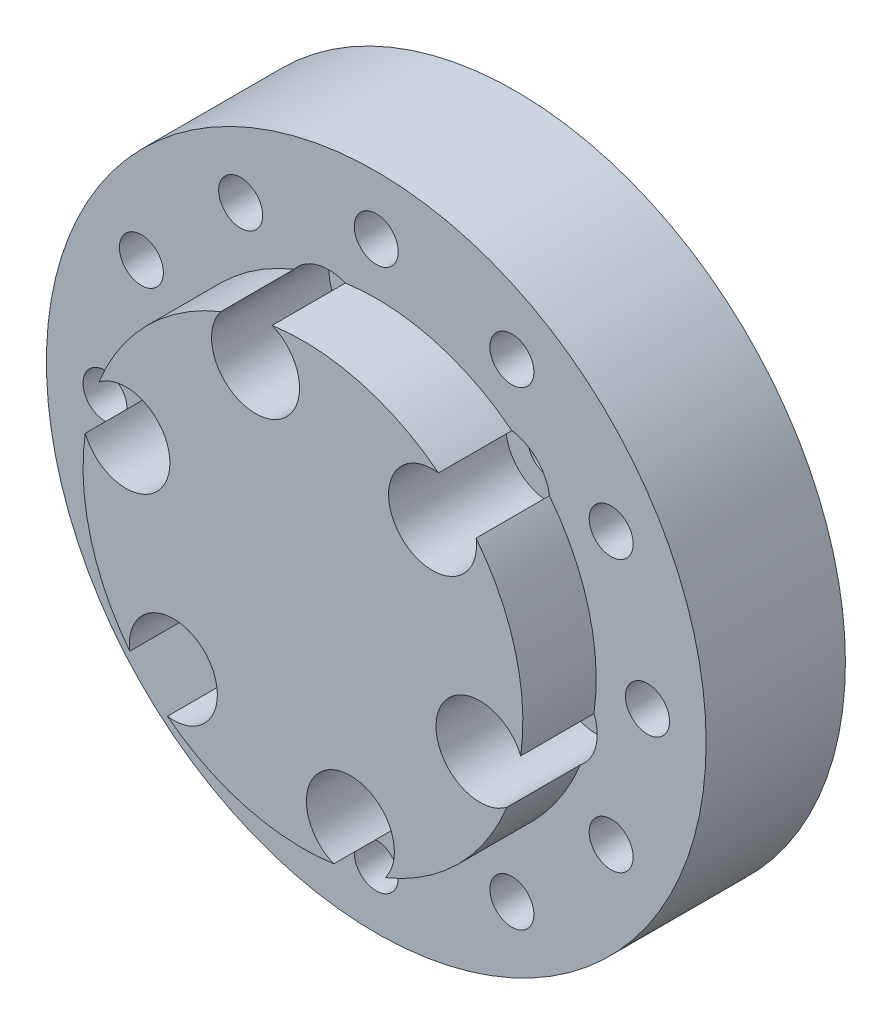
from build123d import *

# Parameters (mm, degrees)
SKETCH_1_R               = 22.5
EXTRUDE_1_DEPTH          = 9.5
SKETCH_2_R               = 15
EXTRUDE_2_DEPTH          = 5
SKETCH_3_R               = 1.5
CUT_EXTRUDE_1_DEPTH      = 5
SKETCH_5_R               = 1.5
CUT_EXTRUDE_2_DEPTH      = 34.207679835
CUT_EXTRUDE_6_DEPTH      = 3
PATTERN_CIRCULAR_1_COUNT = 12
SKETCH_6_R               = 1.5
CUT_EXTRUDE_3_DEPTH      = 35.96784237
SKETCH_7_R               = 3
CUT_EXTRUDE_4_DEPTH      = 8
PATTERN_CIRCULAR_2_COUNT = 6
SKETCH_8_R               = 2
CUT_EXTRUDE_5_DEPTH      = 4
PATTERN_CIRCULAR_3_COUNT = 6


with BuildPart() as part:
    # 草图1 → 凸台-拉伸1 (new body)
    with BuildSketch(Plane.XY):
        Circle(SKETCH_1_R)
    extrude(amount=EXTRUDE_1_DEPTH)

    # 草图2 → 凸台-拉伸2 (add)
    with BuildSketch(Plane.XY.offset(9.5)):
        Circle(SKETCH_2_R)
    extrude(amount=EXTRUDE_2_DEPTH)

    # 草图3 → 切除-拉伸1 (cut)
    with BuildSketch(Plane.XY.offset(9.5)):
        with Locations((0, 18.5)):
            Circle(SKETCH_3_R)
    cut_extrude_1 = extrude(amount=-CUT_EXTRUDE_1_DEPTH, mode=Mode.SUBTRACT)

    # 草图5 → 切除-拉伸2 (cut, through all)
    with BuildSketch(Plane.XY.offset(9.5)):
        with Locations((0, 18.5)):
            Circle(SKETCH_5_R)
    cut_extrude_2 = extrude(amount=-CUT_EXTRUDE_2_DEPTH, mode=Mode.SUBTRACT)

    # 草图9 → 切除-拉伸6 (cut)
    with BuildSketch(Plane(origin=(0, 0, 0), x_dir=(-1, 0, 0), z_dir=(0, 0, -1))):
        Polygon((1.204492644, 21.438116881), (-1.942237536, 21.012179669), (-3.14673018, 18.074062788), (-1.204492644, 15.561883119), (1.942237536, 15.987820331), (3.14673018, 18.925937212), align=None)
    cut_extrude_6 = extrude(amount=-CUT_EXTRUDE_6_DEPTH, mode=Mode.SUBTRACT)

    # 阵列(圆周)1: 切除-拉伸1, 切除-拉伸2, 切除-拉伸6 ×12 about axis
    pattern_circular_1_axis = Axis((0, 0, 0), (0, 0, 1))
    add([cut_extrude_1.rotate(pattern_circular_1_axis, i * 360 / PATTERN_CIRCULAR_1_COUNT) for i in range(1, PATTERN_CIRCULAR_1_COUNT)], mode=Mode.SUBTRACT)
    add([cut_extrude_2.rotate(pattern_circular_1_axis, i * 360 / PATTERN_CIRCULAR_1_COUNT) for i in range(1, PATTERN_CIRCULAR_1_COUNT)], mode=Mode.SUBTRACT)
    add([cut_extrude_6.rotate(pattern_circular_1_axis, i * 360 / PATTERN_CIRCULAR_1_COUNT) for i in range(1, PATTERN_CIRCULAR_1_COUNT)], mode=Mode.SUBTRACT)

    # 草图6 → 切除-拉伸3 (cut, through all)
    with BuildSketch(Plane(origin=(0, 0, 0), x_dir=(-1, 0, 0), z_dir=(0, 0, -1))):
        with Locations((3.235238064, 12.074072829)):
            Circle(SKETCH_6_R)
    cut_extrude_3 = extrude(amount=-CUT_EXTRUDE_3_DEPTH, mode=Mode.SUBTRACT)

    # 草图7 → 切除-拉伸4 (cut)
    with BuildSketch(Plane.XY.offset(14.5)):
        with Locations((-3.235238064, 12.074072829)):
            Circle(SKETCH_7_R)
    cut_extrude_4 = extrude(amount=-CUT_EXTRUDE_4_DEPTH, mode=Mode.SUBTRACT)

    # 阵列(圆周)2: 切除-拉伸3, 切除-拉伸4 ×6 about axis
    pattern_circular_2_axis = Axis((0, 0, 0), (0, 0, 1))
    add([cut_extrude_3.rotate(pattern_circular_2_axis, i * 360 / PATTERN_CIRCULAR_2_COUNT) for i in range(1, PATTERN_CIRCULAR_2_COUNT)], mode=Mode.SUBTRACT)
    add([cut_extrude_4.rotate(pattern_circular_2_axis, i * 360 / PATTERN_CIRCULAR_2_COUNT) for i in range(1, PATTERN_CIRCULAR_2_COUNT)], mode=Mode.SUBTRACT)

    # 草图8 → 切除-拉伸5 (cut)
    with BuildSketch(Plane(origin=(0, 0, 0), x_dir=(-1, 0, 0), z_dir=(0, 0, -1))):
        with Locations((-2.63995426, 9.852443428)):
            Circle(SKETCH_8_R)
    cut_extrude_5 = extrude(amount=-CUT_EXTRUDE_5_DEPTH, mode=Mode.SUBTRACT)

    # 阵列(圆周)3: 切除-拉伸5 ×6 about axis
    pattern_circular_3_axis = Axis((0, 0, 0), (0, 0, 1))
    for i in range(1, PATTERN_CIRCULAR_3_COUNT):
        add(cut_extrude_5.rotate(pattern_circular_3_axis, i * 360 / PATTERN_CIRCULAR_3_COUNT), mode=Mode.SUBTRACT)


solid = part.part
